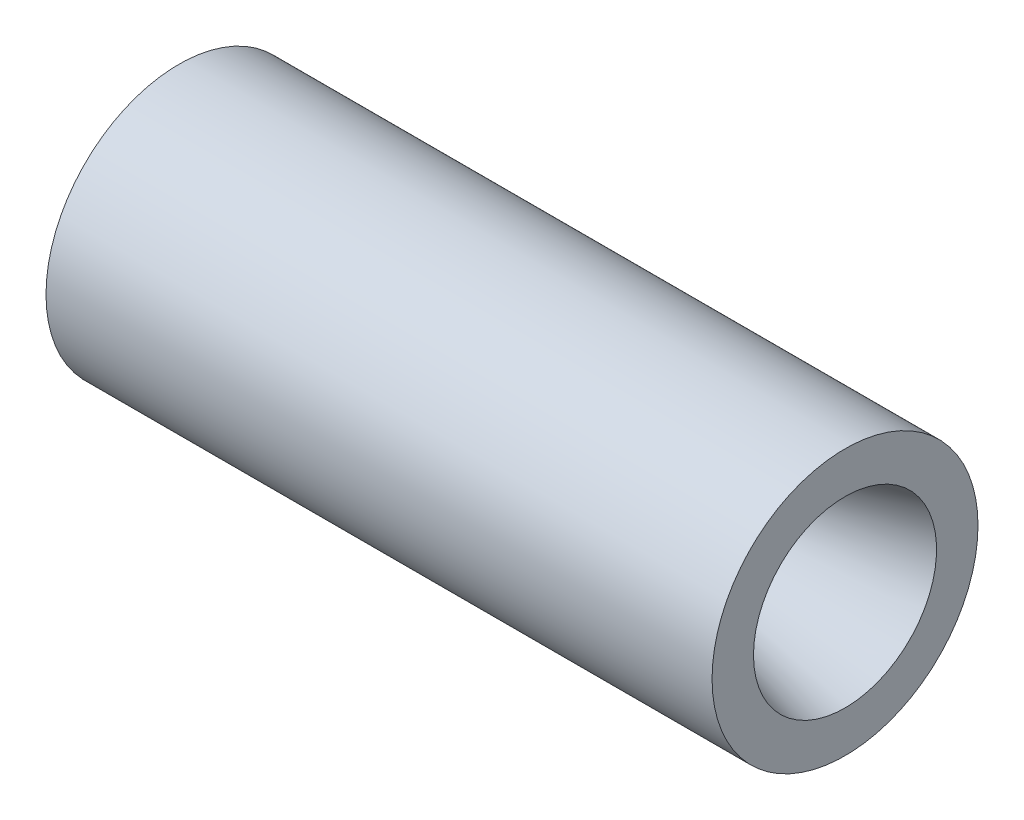
from build123d import *


with BuildPart() as part:
    # Sketch1 → Revolve2 (revolve)
    with BuildSketch(Plane.XY, mode=Mode.PRIVATE) as revolve2_sk:
        with BuildLine():
            Line((0, 43.2765708), (142.96691498, 43.2765708))
            ThreePointArc((142.96691498, 43.2765708), (148.071235785, 42.490940687), (152.703069528, 40.206773063))
            Line((152.703069528, 40.206773063), (181.498114964, 20.044265185))
            ThreePointArc((181.498114964, 20.044265185), (188.286684173, 17.23234775), (195.627584968, 17.5528584))
            Line((195.627584968, 17.5528584), (267.174285764, 36.7237391))
            Line((267.174285764, 36.7237391), (267.174285764, 53.34))
            Line((267.174285764, 53.34), (0, 53.34))
            Line((0, 53.34), (0, 43.2765708))
        make_face()
    revolve(revolve2_sk.sketch.rotate(Axis((0, 0, 0), (1, 0, 0)), 90), axis=Axis((0, 0, 0), (1, 0, 0)))


solid = part.part
